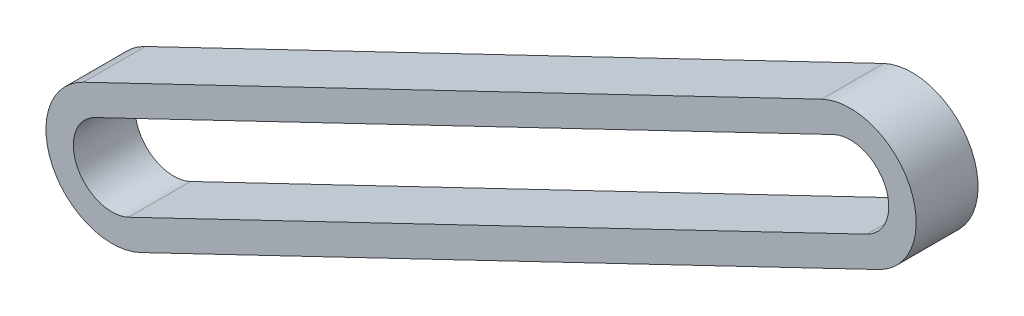
from build123d import *

# Parameters (mm, degrees)
BOSS_EXTRUDE1_DEPTH = 3


with BuildPart() as part:
    # Sketch1 → Boss-Extrude1 (new body)
    with BuildSketch(Plane.XY):
        with BuildLine():
            Line((-1.384918209, 2.884787957), (34.415081791, 20.071518007))
            ThreePointArc((34.415081791, 20.071518007), (38.684787957, 18.571648259), (37.184918209, 14.301942094))
            Line((37.184918209, 14.301942094), (1.384918209, -2.884787957))
            ThreePointArc((1.384918209, -2.884787957), (-2.884787957, -1.384918209), (-1.384918209, 2.884787957))
        make_face()
        with BuildLine():
            Line((-0.810177152, 1.687600955), (34.989822848, 18.874331005))
            ThreePointArc((34.989822848, 18.874331005), (37.487600955, 17.996907202), (36.610177152, 15.499129096))
            Line((36.610177152, 15.499129096), (0.810177152, -1.687600955))
            ThreePointArc((0.810177152, -1.687600955), (-1.687600955, -0.810177152), (-0.810177152, 1.687600955))
        make_face(mode=Mode.SUBTRACT)
    extrude(amount=-BOSS_EXTRUDE1_DEPTH)


solid = part.part
